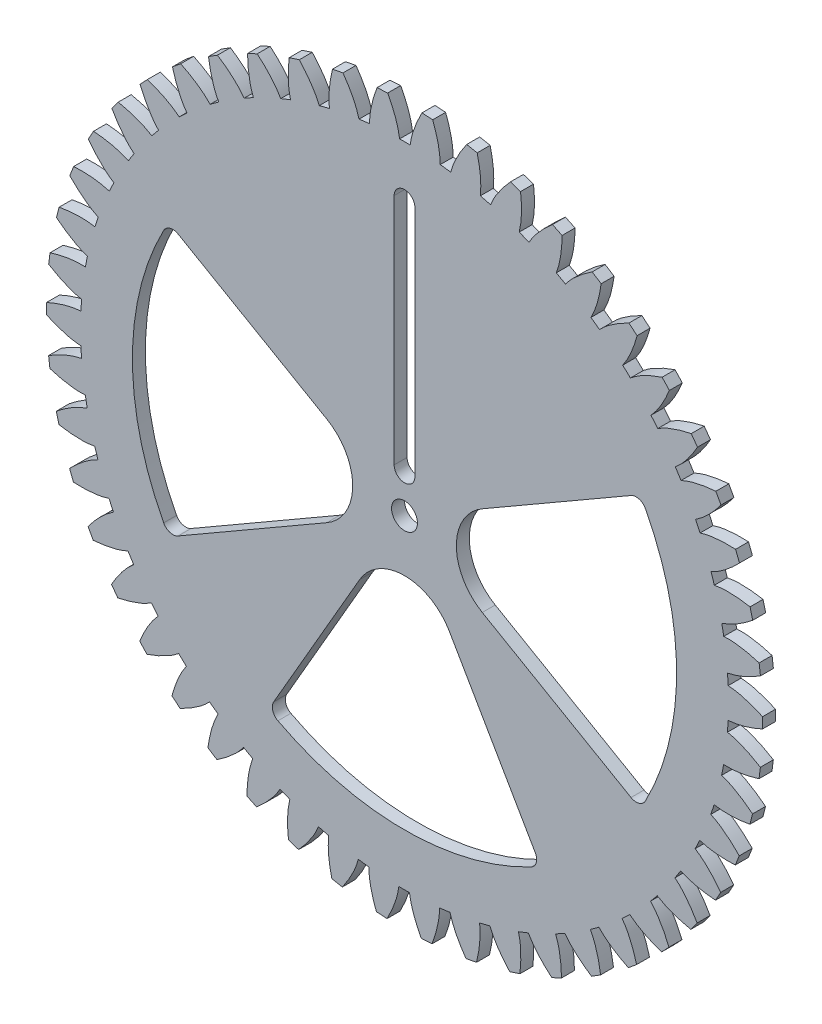
from build123d import *

# Parameters (mm, degrees)
SPIRALSKETCH_R      = 6.35
BOSS_EXTRUDE1_DEPTH = 6.35
CUT_EXTRUDE1_DEPTH  = 6.35


with BuildPart() as part:
    # spiralSketch → Boss-Extrude1 (new body)
    with BuildSketch(Plane.XY):
        with BuildLine():
            Line((30.468459497, 172.815087406), (35.608653157, 171.829582085))
            add(Edge.make_bspline(
                [(37.148806911, 154.342245173), (37.831936538, 160.209299594), (36.978815149, 166.129159813), (35.608653157, 171.829582085)],
                knots=[0, 0, 0, 0, 1, 1, 1, 1], degree=3))
            ThreePointArc((37.148806911, 154.342245173), (39.66463326, 153.714928905), (42.169878451, 153.046606795))
            add(Edge.make_bspline(
                [(42.169878451, 153.046606795), (44.310689074, 158.5527263), (47.962178229, 163.294360615), (51.887680307, 167.633678274)],
                knots=[0, 0, 0, 0, 1, 1, 1, 1], degree=3))
            Line((51.887680307, 167.633678274), (56.863825436, 166.011706865))
            add(Edge.make_bspline(
                [(56.200090136, 148.469230377), (57.613169984, 154.204402477), (57.508730936, 160.184507291), (56.863825436, 166.011706865)],
                knots=[0, 0, 0, 0, 1, 1, 1, 1], degree=3))
            ThreePointArc((56.200090136, 148.469230377), (58.617454866, 147.531544034), (61.01918248, 146.554501362))
            add(Edge.make_bspline(
                [(61.01918248, 146.554501362), (63.833211933, 151.748888752), (68.050192367, 155.995480921), (72.488601402, 159.808585896)],
                knots=[0, 0, 0, 0, 1, 1, 1, 1], degree=3))
            Line((72.488601402, 159.808585896), (77.222221219, 157.575727856))
            add(Edge.make_bspline(
                [(74.365064367, 140.254767126), (76.485809323, 145.767609814), (77.131699681, 151.7136494), (77.222221219, 157.575727856)],
                knots=[0, 0, 0, 0, 1, 1, 1, 1], degree=3))
            ThreePointArc((74.365064367, 140.254767126), (76.645844193, 139.021498582), (78.90617755, 137.751143895))
            add(Edge.make_bspline(
                [(78.90617755, 137.751143895), (82.349046908, 142.551880579), (87.06501432, 146.236459307), (91.94633395, 149.463216654)],
                knots=[0, 0, 0, 0, 1, 1, 1, 1], degree=3))
            Line((91.94633395, 149.463216654), (96.362776443, 146.654685488))
            add(Edge.make_bspline(
                [(91.357257109, 129.828402414), (94.152221758, 135.031974868), (95.538255446, 140.850176629), (96.362776443, 146.654685488)],
                knots=[0, 0, 0, 0, 1, 1, 1, 1], degree=3))
            ThreePointArc((91.357257109, 129.828402414), (93.46548277, 128.31900105), (95.548775063, 126.775368601))
            add(Edge.make_bspline(
                [(95.548775063, 126.775368601), (99.566188221, 131.106744093), (104.706768987, 134.171201371), (109.954017886, 136.7607232)],
                knots=[0, 0, 0, 0, 1, 1, 1, 1], degree=3))
            Line((109.954017886, 136.7607232), (113.983633118, 133.420811122))
            add(Edge.make_bspline(
                [(106.908691333, 117.35456624), (110.333797412, 122.166805014), (112.438115851, 127.765412432), (113.983633118, 133.420811122)],
                knots=[0, 0, 0, 0, 1, 1, 1, 1], degree=3))
            ThreePointArc((106.908691333, 117.35456624), (108.811114851, 115.592836218), (110.684511316, 113.800270012))
            add(Edge.make_bspline(
                [(110.684511316, 113.800270012), (115.213111267, 117.593975932), (120.697235358, 119.98998344), (126.227661276, 121.901431444)],
                knots=[0, 0, 0, 0, 1, 1, 1, 1], degree=3))
            Line((126.227661276, 121.901431444), (129.806899808, 118.082810864))
            add(Edge.make_bspline(
                [(120.77411163, 103.029978452), (124.775343171, 107.374991666), (127.564760002, 112.665711358), (129.806899808, 118.082810864)],
                knots=[0, 0, 0, 0, 1, 1, 1, 1], degree=3))
            ThreePointArc((120.77411163, 103.029978452), (122.44073065, 101.043703306), (124.074686705, 99.030473184))
            add(Edge.make_bspline(
                [(124.074686705, 99.030473184), (129.043054723, 102.226680524), (134.784234227, 103.916451792), (140.510619044, 105.119681294)],
                knots=[0, 0, 0, 0, 1, 1, 1, 1], degree=3))
            Line((140.510619044, 105.119681294), (143.583034146, 100.882574138))
            add(Edge.make_bspline(
                [(132.73485204, 87.080546357), (137.249107231, 90.889810556), (140.679631683, 95.789204712), (143.583034146, 100.882574138)],
                knots=[0, 0, 0, 0, 1, 1, 1, 1], degree=3))
            ThreePointArc((132.73485204, 87.080546357), (134.139382985, 84.901050833), (135.508130167, 82.698906635))
            add(Edge.make_bspline(
                [(135.508130167, 82.698906635), (140.83791212, 85.247209297), (146.745605205, 86.204095622), (152.577640412, 86.680130974)],
                knots=[0, 0, 0, 0, 1, 1, 1, 1], degree=3))
            Line((152.577640412, 86.680130974), (155.094778262, 82.091358955))
            add(Edge.make_bspline(
                [(142.602284541, 69.757802027), (147.558370882, 72.97124284), (151.575901536, 77.402045087), (155.094778262, 82.091358955)],
                knots=[0, 0, 0, 0, 1, 1, 1, 1], degree=3))
            ThreePointArc((142.602284541, 69.757802027), (143.722577118, 67.419458071), (144.804529467, 65.063128928))
            add(Edge.make_bspline(
                [(144.804529467, 65.063128928), (150.41167151, 66.923338655), (156.392710328, 67.132249368), (162.238421245, 66.873583209)],
                knots=[0, 0, 0, 0, 1, 1, 1, 1], degree=3))
            Line((162.238421245, 66.873583209), (164.160585077, 62.005514001))
            add(Edge.make_bspline(
                [(150.220793829, 51.334935487), (155.540550876, 53.901875032), (160.081728874, 57.794208973), (164.160585077, 62.005514001)],
                knots=[0, 0, 0, 0, 1, 1, 1, 1], degree=3))
            ThreePointArc((150.220793829, 51.334935487), (151.039180355, 48.87462018), (151.817274835, 46.40126681))
            add(Edge.make_bspline(
                [(151.817274835, 46.40126681), (157.613348989, 47.544046985), (163.573408985, 47.001687439), (169.340605259, 46.012399088)],
                knots=[0, 0, 0, 0, 1, 1, 1, 1], degree=3))
            Line((169.340605259, 46.012399088), (170.6374814, 40.941805052))
            add(Edge.make_bspline(
                [(155.47023146, 32.102486348), (161.069763468, 33.982442456), (166.062971719, 37.274923658), (170.6374814, 40.941805052)],
                knots=[0, 0, 0, 0, 1, 1, 1, 1], degree=3))
            ThreePointArc((155.47023146, 32.102486348), (155.973805491, 29.559000333), (156.435771088, 27.007628995))
            add(Edge.make_bspline(
                [(156.435771088, 27.007628995), (162.329369801, 27.414957292), (168.174457268, 26.129880822), (173.772186769, 24.425571947)],
                knots=[0, 0, 0, 0, 1, 1, 1, 1], degree=3))
            Line((173.772186769, 24.425571947), (174.423322707, 19.232419379))
            add(Edge.make_bspline(
                [(158.267810668, 12.363761823), (164.058809671, 13.527086463), (169.4253023, 16.167790531), (174.423322707, 19.232419379)],
                knots=[0, 0, 0, 0, 1, 1, 1, 1], degree=3))
            ThreePointArc((158.267810668, 12.363761823), (158.44863054, 9.777217393), (158.587181781, 7.188064738))
            add(Edge.make_bspline(
                [(158.587181781, 7.188064738), (164.48535948, 6.853517346), (170.123293897, 4.845990375), (175.463277087, 2.453538945)],
                knots=[0, 0, 0, 0, 1, 1, 1, 1], degree=3))
            Line((175.463277087, 2.453538945), (175.45840402, -2.780273036))
            add(Edge.make_bspline(
                [(158.569411957, -7.569946612), (164.460550442, -7.141599765), (170.115694653, -5.194318311), (175.45840402, -2.780273036)],
                knots=[0, 0, 0, 0, 1, 1, 1, 1], degree=3))
            ThreePointArc((158.569411957, -7.569946612), (158.424626033, -10.158758106), (158.237577882, -12.744859593))
            add(Edge.make_bspline(
                [(158.237577882, -12.744859593), (164.047316782, -13.816006663), (169.389184555, -16.514324235), (174.387206708, -19.557187831)],
                knots=[0, 0, 0, 0, 1, 1, 1, 1], degree=3))
            Line((174.387206708, -19.557187831), (173.726401487, -24.749118884))
            add(Edge.make_bspline(
                [(156.370278894, -27.384272467), (162.268650088, -27.697658698), (168.12326088, -26.474509651), (173.726401487, -24.749118884)],
                knots=[0, 0, 0, 0, 1, 1, 1, 1], degree=3))
            ThreePointArc((156.370278894, -27.384272467), (155.902170535, -29.934523921), (155.392472853, -32.476789876))
            add(Edge.make_bspline(
                [(155.392472853, -32.476789876), (161.0221499, -34.267643994), (165.983706584, -37.614198087), (170.560945906, -41.259486073)],
                knots=[0, 0, 0, 0, 1, 1, 1, 1], degree=3))
            Line((170.560945906, -41.259486073), (169.254629824, -46.327656344))
            add(Edge.make_bspline(
                [(151.705093123, -46.766731986), (157.517676188, -47.816909008), (163.47942285, -47.337182158), (169.254629824, -46.327656344)],
                knots=[0, 0, 0, 0, 1, 1, 1, 1], degree=3))
            ThreePointArc((151.705093123, -46.766731986), (150.921044677, -49.238204412), (150.0967357, -51.696541782))
            add(Edge.make_bspline(
                [(150.0967357, -51.696541782), (155.457567525, -54.178860108), (159.960566406, -58.120873566), (164.044837099, -62.311097571)],
                knots=[0, 0, 0, 0, 1, 1, 1, 1], degree=3))
            Line((164.044837099, -62.311097571), (162.113611541, -67.175578988))
            add(Edge.make_bspline(
                [(144.647427408, -65.411652205), (150.282554438, -67.182058099), (156.257416664, -67.453319025), (162.113611541, -67.175578988)],
                knots=[0, 0, 0, 0, 1, 1, 1, 1], degree=3))
            ThreePointArc((144.647427408, -65.411652205), (143.559803788, -67.765369005), (142.433883362, -70.101008342))
            add(Edge.make_bspline(
                [(142.433883362, -70.101008342), (147.441326444, -73.235643234), (151.414752541, -77.710948148), (154.941643215, -82.380025839)],
                knots=[0, 0, 0, 0, 1, 1, 1, 1], degree=3))
            Line((154.941643215, -82.380025839), (152.415964762, -86.964102622))
            add(Edge.make_bspline(
                [(135.308585355, -83.024991594), (140.67738703, -85.487706), (146.571137674, -86.505676756), (152.415964762, -86.964102622)],
                knots=[0, 0, 0, 0, 1, 1, 1, 1], degree=3))
            ThreePointArc((135.308585355, -83.024991594), (133.934539034, -85.223833249), (132.524763597, -87.399940124))
            add(Edge.make_bspline(
                [(132.524763597, -87.399940124), (137.099847567, -91.137456517), (140.481037577, -96.075474656), (143.39492706, -101.149771887)],
                knots=[0, 0, 0, 0, 1, 1, 1, 1], degree=3))
            Line((143.39492706, -101.149771887), (140.31462717, -105.381150409))
            add(Edge.make_bspline(
                [(123.835846082, -99.328977268), (128.853653192, -102.445161711), (134.573344285, -104.193788289), (140.31462717, -105.381150409)],
                knots=[0, 0, 0, 0, 1, 1, 1, 1], degree=3))
            ThreePointArc((123.835846082, -99.328977268), (122.197046592, -101.338266732), (120.525649144, -103.32052264))
            add(Edge.make_bspline(
                [(120.525649144, -103.32052264), (124.596222196, -107.601977667), (127.331852731, -112.924833536), (129.586787245, -118.324325609)],
                knots=[0, 0, 0, 0, 1, 1, 1, 1], degree=3))
            Line((129.586787245, -118.324325609), (126.000444087, -122.136274501))
            add(Edge.make_bspline(
                [(110.41014154, -114.066485635), (114.99782027, -117.786996023), (120.453248867, -120.238701538), (126.000444087, -122.136274501)],
                knots=[0, 0, 0, 0, 1, 1, 1, 1], degree=3))
            ThreePointArc((110.41014154, -114.066485635), (108.532433728, -115.854535212), (106.625773205, -117.611678793))
            add(Edge.make_bspline(
                [(106.625773205, -117.611678793), (110.12763997, -122.369551352), (112.174568503, -127.993300333), (113.734986384, -133.632834032)],
                knots=[0, 0, 0, 0, 1, 1, 1, 1], degree=3))
            Line((113.734986384, -133.632834032), (109.699158732, -136.965236585))
            add(Edge.make_bspline(
                [(95.24320311, -127.005097383), (99.328403025, -131.271259045), (104.433533758, -134.387378636), (109.699158732, -136.965236585)],
                knots=[0, 0, 0, 0, 1, 1, 1, 1], degree=3))
            ThreePointArc((95.24320311, -127.005097383), (93.15619955, -128.543708463), (91.044345128, -130.048028514))
            add(Edge.make_bspline(
                [(91.044345128, -130.048028514), (93.922279074, -135.207284112), (95.24822432, -141.043236325), (96.089516846, -146.833872835)],
                knots=[0, 0, 0, 0, 1, 1, 1, 1], degree=3))
            Line((96.089516846, -146.833872835), (91.667852113, -149.634175068))
            add(Edge.make_bspline(
                [(78.574222471, -137.940762877), (82.092517529, -142.685295895), (86.766839437, -146.416686495), (91.667852113, -149.634175068)],
                knots=[0, 0, 0, 0, 1, 1, 1, 1], degree=3))
            ThreePointArc((78.574222471, -137.940762877), (76.310836456, -139.205670644), (74.02709334, -140.433443138))
            add(Edge.make_bspline(
                [(74.02709334, -140.433443138), (76.235707731, -145.912717232), (76.819758741, -151.868836224), (76.928658226, -157.719253748)],
                knots=[0, 0, 0, 0, 1, 1, 1, 1], degree=3))
            Line((76.928658226, -157.719253748), (72.190888706, -159.943293223))
            add(Edge.make_bspline(
                [(60.666079407, -146.701020138), (63.561983992, -151.849100392), (67.731780226, -156.136915742), (72.190888706, -159.943293223)],
                knots=[0, 0, 0, 0, 1, 1, 1, 1], degree=3))
            ThreePointArc((60.666079407, -146.701020138), (58.262005885, -147.672276241), (55.84239007, -148.604138473))
            add(Edge.make_bspline(
                [(55.84239007, -148.604138473), (57.346853736, -154.317019638), (57.179799677, -160.299373854), (56.55458871, -166.117307813)],
                knots=[0, 0, 0, 0, 1, 1, 1, 1], degree=3))
            Line((56.55458871, -166.117307813), (51.57543186, -167.730010099))
            add(Edge.make_bspline(
                [(41.801196029, -153.147714676), (44.029039997, -158.618153866), (47.62855038, -163.394772556), (51.57543186, -167.730010099)],
                knots=[0, 0, 0, 0, 1, 1, 1, 1], degree=3))
            ThreePointArc((41.801196029, -153.147714676), (39.294348678, -153.810001827), (36.777018949, -154.431257773))
            add(Edge.make_bspline(
                [(36.777018949, -154.431257773), (37.553605601, -160.287650459), (36.638081014, -166.2018946), (35.288619547, -171.8955927)],
                knots=[0, 0, 0, 0, 1, 1, 1, 1], degree=3))
            Line((35.288619547, -171.8955927), (30.146599644, -172.871524518))
            add(Edge.make_bspline(
                [(22.27708282, -157.179178268), (23.80173174, -162.885704299), (26.774189842, -168.0757962), (30.146599644, -172.871524518)],
                knots=[0, 0, 0, 0, 1, 1, 1, 1], degree=3))
            ThreePointArc((22.27708282, -157.179178268), (19.706996118, -157.522051802), (17.131652269, -157.822903884))
            add(Edge.make_bspline(
                [(17.131652269, -157.822903884), (17.168114671, -163.730449282), (15.518557928, -169.483312184), (13.466127773, -174.962981405)],
                knots=[0, 0, 0, 0, 1, 1, 1, 1], degree=3))
            Line((13.466127773, -174.962981405), (8.242337542, -175.286751727))
            add(Edge.make_bspline(
                [(2.401646707, -158.731832325), (3.199055955, -164.584449872), (5.497584337, -170.106164134), (8.242337542, -175.286751727)],
                knots=[0, 0, 0, 0, 1, 1, 1, 1], degree=3))
            ThreePointArc((2.401646707, -158.731832325), (-0.191147542, -158.749884922), (-2.7838908, -158.725588523))
            add(Edge.make_bspline(
                [(-2.7838908, -158.725588523), (-3.488127682, -164.591121111), (-5.845702088, -170.091876691), (-8.56873288, -175.271099375)],
                knots=[0, 0, 0, 0, 1, 1, 1, 1], degree=3))
            Line((-8.56873288, -175.271099375), (-13.791911146, -174.937602151))
            add(Edge.make_bspline(
                [(-17.51166481, -157.781190563), (-17.454070854, -163.687600353), (-15.865721358, -169.453856244), (-13.791911146, -174.937602151)],
                knots=[0, 0, 0, 0, 1, 1, 1, 1], degree=3))
            ThreePointArc((-17.51166481, -157.781190563), (-20.086276692, -157.474137523), (-22.655530249, -157.125075813))
            add(Edge.make_bspline(
                [(-22.655530249, -157.125075813), (-24.089360178, -162.856092639), (-27.11777189, -168.017990694), (-30.468459497, -172.815087406)],
                knots=[0, 0, 0, 0, 1, 1, 1, 1], degree=3))
            Line((-30.468459497, -172.815087406), (-35.608653157, -171.829582085))
            add(Edge.make_bspline(
                [(-37.148806911, -154.342245173), (-37.831936538, -160.209299595), (-36.978815149, -166.129159813), (-35.608653157, -171.829582085)],
                knots=[0, 0, 0, 0, 1, 1, 1, 1], degree=3))
            ThreePointArc((-37.148806911, -154.342245173), (-39.664633259, -153.714928905), (-42.169878451, -153.046606795))
            add(Edge.make_bspline(
                [(-42.169878451, -153.046606795), (-44.310689074, -158.5527263), (-47.962178229, -163.294360615), (-51.887680306, -167.633678274)],
                knots=[0, 0, 0, 0, 1, 1, 1, 1], degree=3))
            Line((-51.887680306, -167.633678274), (-56.863825436, -166.011706865))
            add(Edge.make_bspline(
                [(-56.200090136, -148.469230377), (-57.613169984, -154.204402477), (-57.508730936, -160.184507291), (-56.863825436, -166.011706865)],
                knots=[0, 0, 0, 0, 1, 1, 1, 1], degree=3))
            ThreePointArc((-56.200090136, -148.469230377), (-58.617454866, -147.531544034), (-61.01918248, -146.554501362))
            add(Edge.make_bspline(
                [(-61.01918248, -146.554501362), (-63.833211933, -151.748888752), (-68.050192367, -155.995480921), (-72.488601402, -159.808585896)],
                knots=[0, 0, 0, 0, 1, 1, 1, 1], degree=3))
            Line((-72.488601402, -159.808585896), (-77.222221219, -157.575727856))
            add(Edge.make_bspline(
                [(-74.365064367, -140.254767126), (-76.485809323, -145.767609815), (-77.131699681, -151.7136494), (-77.222221219, -157.575727856)],
                knots=[0, 0, 0, 0, 1, 1, 1, 1], degree=3))
            ThreePointArc((-74.365064367, -140.254767126), (-76.645844193, -139.021498582), (-78.90617755, -137.751143896))
            add(Edge.make_bspline(
                [(-78.90617755, -137.751143896), (-82.349046908, -142.551880579), (-87.06501432, -146.236459307), (-91.94633395, -149.463216654)],
                knots=[0, 0, 0, 0, 1, 1, 1, 1], degree=3))
            Line((-91.94633395, -149.463216654), (-96.362776443, -146.654685488))
            add(Edge.make_bspline(
                [(-91.357257109, -129.828402414), (-94.152221758, -135.031974868), (-95.538255446, -140.850176629), (-96.362776443, -146.654685488)],
                knots=[0, 0, 0, 0, 1, 1, 1, 1], degree=3))
            ThreePointArc((-91.357257109, -129.828402414), (-93.46548277, -128.31900105), (-95.548775063, -126.775368601))
            add(Edge.make_bspline(
                [(-95.548775063, -126.775368601), (-99.566188221, -131.106744093), (-104.706768987, -134.171201371), (-109.954017886, -136.7607232)],
                knots=[0, 0, 0, 0, 1, 1, 1, 1], degree=3))
            Line((-109.954017886, -136.7607232), (-113.983633118, -133.420811122))
            add(Edge.make_bspline(
                [(-106.908691333, -117.35456624), (-110.333797412, -122.166805014), (-112.438115851, -127.765412432), (-113.983633118, -133.420811122)],
                knots=[0, 0, 0, 0, 1, 1, 1, 1], degree=3))
            ThreePointArc((-106.908691333, -117.35456624), (-108.811114851, -115.592836218), (-110.684511316, -113.800270012))
            add(Edge.make_bspline(
                [(-110.684511316, -113.800270012), (-115.213111267, -117.593975932), (-120.697235358, -119.98998344), (-126.227661276, -121.901431444)],
                knots=[0, 0, 0, 0, 1, 1, 1, 1], degree=3))
            Line((-126.227661276, -121.901431444), (-129.806899808, -118.082810864))
            add(Edge.make_bspline(
                [(-120.77411163, -103.029978452), (-124.775343171, -107.374991666), (-127.564760002, -112.665711358), (-129.806899808, -118.082810864)],
                knots=[0, 0, 0, 0, 1, 1, 1, 1], degree=3))
            ThreePointArc((-120.77411163, -103.029978452), (-122.44073065, -101.043703306), (-124.074686705, -99.030473184))
            add(Edge.make_bspline(
                [(-124.074686705, -99.030473184), (-129.043054723, -102.226680524), (-134.784234227, -103.916451792), (-140.510619044, -105.119681294)],
                knots=[0, 0, 0, 0, 1, 1, 1, 1], degree=3))
            Line((-140.510619044, -105.119681294), (-143.583034146, -100.882574138))
            add(Edge.make_bspline(
                [(-132.73485204, -87.080546357), (-137.249107231, -90.889810557), (-140.679631683, -95.789204712), (-143.583034146, -100.882574138)],
                knots=[0, 0, 0, 0, 1, 1, 1, 1], degree=3))
            ThreePointArc((-132.73485204, -87.080546357), (-134.139382985, -84.901050833), (-135.508130167, -82.698906636))
            add(Edge.make_bspline(
                [(-135.508130167, -82.698906636), (-140.83791212, -85.247209297), (-146.745605205, -86.204095622), (-152.577640412, -86.680130974)],
                knots=[0, 0, 0, 0, 1, 1, 1, 1], degree=3))
            Line((-152.577640412, -86.680130974), (-155.094778262, -82.091358955))
            add(Edge.make_bspline(
                [(-142.602284541, -69.757802027), (-147.558370882, -72.97124284), (-151.575901536, -77.402045087), (-155.094778262, -82.091358955)],
                knots=[0, 0, 0, 0, 1, 1, 1, 1], degree=3))
            ThreePointArc((-142.602284541, -69.757802027), (-143.722577118, -67.419458071), (-144.804529467, -65.063128928))
            add(Edge.make_bspline(
                [(-144.804529467, -65.063128928), (-150.41167151, -66.923338655), (-156.392710328, -67.132249368), (-162.238421245, -66.873583209)],
                knots=[0, 0, 0, 0, 1, 1, 1, 1], degree=3))
            Line((-162.238421245, -66.873583209), (-164.160585077, -62.005514001))
            add(Edge.make_bspline(
                [(-150.220793829, -51.334935487), (-155.540550876, -53.901875032), (-160.081728874, -57.794208973), (-164.160585077, -62.005514001)],
                knots=[0, 0, 0, 0, 1, 1, 1, 1], degree=3))
            ThreePointArc((-150.220793829, -51.334935487), (-151.039180355, -48.87462018), (-151.817274835, -46.40126681))
            add(Edge.make_bspline(
                [(-151.817274835, -46.40126681), (-157.613348989, -47.544046985), (-163.573408985, -47.001687439), (-169.340605259, -46.012399088)],
                knots=[0, 0, 0, 0, 1, 1, 1, 1], degree=3))
            Line((-169.340605259, -46.012399088), (-170.6374814, -40.941805052))
            add(Edge.make_bspline(
                [(-155.47023146, -32.102486348), (-161.069763468, -33.982442456), (-166.062971719, -37.274923658), (-170.6374814, -40.941805052)],
                knots=[0, 0, 0, 0, 1, 1, 1, 1], degree=3))
            ThreePointArc((-155.47023146, -32.102486348), (-155.973805491, -29.559000333), (-156.435771088, -27.007628996))
            add(Edge.make_bspline(
                [(-156.435771088, -27.007628996), (-162.329369801, -27.414957292), (-168.174457268, -26.129880822), (-173.772186769, -24.425571947)],
                knots=[0, 0, 0, 0, 1, 1, 1, 1], degree=3))
            Line((-173.772186769, -24.425571947), (-174.423322707, -19.232419379))
            add(Edge.make_bspline(
                [(-158.267810668, -12.363761823), (-164.058809671, -13.527086463), (-169.4253023, -16.167790531), (-174.423322707, -19.232419379)],
                knots=[0, 0, 0, 0, 1, 1, 1, 1], degree=3))
            ThreePointArc((-158.267810668, -12.363761823), (-158.44863054, -9.777217393), (-158.587181781, -7.188064739))
            add(Edge.make_bspline(
                [(-158.587181781, -7.188064739), (-164.48535948, -6.853517346), (-170.123293897, -4.845990375), (-175.463277087, -2.453538945)],
                knots=[0, 0, 0, 0, 1, 1, 1, 1], degree=3))
            Line((-175.463277087, -2.453538945), (-175.45840402, 2.780273036))
            add(Edge.make_bspline(
                [(-158.569411957, 7.569946612), (-164.460550442, 7.141599765), (-170.115694653, 5.194318312), (-175.45840402, 2.780273036)],
                knots=[0, 0, 0, 0, 1, 1, 1, 1], degree=3))
            ThreePointArc((-158.569411957, 7.569946612), (-158.424626033, 10.158758106), (-158.237577882, 12.744859593))
            add(Edge.make_bspline(
                [(-158.237577882, 12.744859593), (-164.047316782, 13.816006663), (-169.389184555, 16.514324235), (-174.387206708, 19.557187831)],
                knots=[0, 0, 0, 0, 1, 1, 1, 1], degree=3))
            Line((-174.387206708, 19.557187831), (-173.726401487, 24.749118884))
            add(Edge.make_bspline(
                [(-156.370278894, 27.384272467), (-162.268650088, 27.697658699), (-168.123260879, 26.474509651), (-173.726401487, 24.749118884)],
                knots=[0, 0, 0, 0, 1, 1, 1, 1], degree=3))
            ThreePointArc((-156.370278894, 27.384272467), (-155.902170535, 29.934523921), (-155.392472853, 32.476789876))
            add(Edge.make_bspline(
                [(-155.392472853, 32.476789876), (-161.0221499, 34.267643994), (-165.983706584, 37.614198087), (-170.560945906, 41.259486073)],
                knots=[0, 0, 0, 0, 1, 1, 1, 1], degree=3))
            Line((-170.560945906, 41.259486073), (-169.254629824, 46.327656344))
            add(Edge.make_bspline(
                [(-151.705093123, 46.766731986), (-157.517676188, 47.816909008), (-163.47942285, 47.337182158), (-169.254629824, 46.327656344)],
                knots=[0, 0, 0, 0, 1, 1, 1, 1], degree=3))
            ThreePointArc((-151.705093123, 46.766731986), (-150.921044677, 49.238204412), (-150.0967357, 51.696541782))
            add(Edge.make_bspline(
                [(-150.0967357, 51.696541782), (-155.457567525, 54.178860108), (-159.960566406, 58.120873566), (-164.044837099, 62.311097571)],
                knots=[0, 0, 0, 0, 1, 1, 1, 1], degree=3))
            Line((-164.044837099, 62.311097571), (-162.113611541, 67.175578988))
            add(Edge.make_bspline(
                [(-144.647427408, 65.411652205), (-150.282554438, 67.182058099), (-156.257416664, 67.453319025), (-162.113611541, 67.175578988)],
                knots=[0, 0, 0, 0, 1, 1, 1, 1], degree=3))
            ThreePointArc((-144.647427408, 65.411652205), (-143.559803788, 67.765369005), (-142.433883362, 70.101008342))
            add(Edge.make_bspline(
                [(-142.433883362, 70.101008342), (-147.441326444, 73.235643234), (-151.414752541, 77.710948148), (-154.941643215, 82.380025839)],
                knots=[0, 0, 0, 0, 1, 1, 1, 1], degree=3))
            Line((-154.941643215, 82.380025839), (-152.415964762, 86.964102622))
            add(Edge.make_bspline(
                [(-135.308585355, 83.024991594), (-140.67738703, 85.487706), (-146.571137674, 86.505676756), (-152.415964762, 86.964102622)],
                knots=[0, 0, 0, 0, 1, 1, 1, 1], degree=3))
            ThreePointArc((-135.308585355, 83.024991594), (-133.934539034, 85.223833249), (-132.524763597, 87.399940124))
            add(Edge.make_bspline(
                [(-132.524763597, 87.399940124), (-137.099847567, 91.137456517), (-140.481037577, 96.075474656), (-143.39492706, 101.149771887)],
                knots=[0, 0, 0, 0, 1, 1, 1, 1], degree=3))
            Line((-143.39492706, 101.149771887), (-140.31462717, 105.381150409))
            add(Edge.make_bspline(
                [(-123.835846082, 99.328977268), (-128.853653192, 102.445161711), (-134.573344285, 104.193788289), (-140.31462717, 105.381150409)],
                knots=[0, 0, 0, 0, 1, 1, 1, 1], degree=3))
            ThreePointArc((-123.835846082, 99.328977268), (-122.197046592, 101.338266732), (-120.525649144, 103.320522639))
            add(Edge.make_bspline(
                [(-120.525649144, 103.320522639), (-124.596222196, 107.601977667), (-127.331852731, 112.924833536), (-129.586787245, 118.324325609)],
                knots=[0, 0, 0, 0, 1, 1, 1, 1], degree=3))
            Line((-129.586787245, 118.324325609), (-126.000444087, 122.136274501))
            add(Edge.make_bspline(
                [(-110.41014154, 114.066485635), (-114.99782027, 117.786996023), (-120.453248867, 120.238701538), (-126.000444087, 122.136274501)],
                knots=[0, 0, 0, 0, 1, 1, 1, 1], degree=3))
            ThreePointArc((-110.41014154, 114.066485635), (-108.532433728, 115.854535212), (-106.625773205, 117.611678793))
            add(Edge.make_bspline(
                [(-106.625773205, 117.611678793), (-110.12763997, 122.369551352), (-112.174568503, 127.993300333), (-113.734986384, 133.632834032)],
                knots=[0, 0, 0, 0, 1, 1, 1, 1], degree=3))
            Line((-113.734986384, 133.632834032), (-109.699158732, 136.965236585))
            add(Edge.make_bspline(
                [(-95.24320311, 127.005097383), (-99.328403025, 131.271259045), (-104.433533758, 134.387378636), (-109.699158732, 136.965236585)],
                knots=[0, 0, 0, 0, 1, 1, 1, 1], degree=3))
            ThreePointArc((-95.24320311, 127.005097383), (-93.15619955, 128.543708463), (-91.044345128, 130.048028514))
            add(Edge.make_bspline(
                [(-91.044345128, 130.048028514), (-93.922279074, 135.207284112), (-95.24822432, 141.043236325), (-96.089516846, 146.833872835)],
                knots=[0, 0, 0, 0, 1, 1, 1, 1], degree=3))
            Line((-96.089516846, 146.833872835), (-91.667852113, 149.634175068))
            add(Edge.make_bspline(
                [(-78.574222471, 137.940762877), (-82.092517529, 142.685295895), (-86.766839437, 146.416686495), (-91.667852113, 149.634175068)],
                knots=[0, 0, 0, 0, 1, 1, 1, 1], degree=3))
            ThreePointArc((-78.574222471, 137.940762877), (-76.310836456, 139.205670644), (-74.02709334, 140.433443138))
            add(Edge.make_bspline(
                [(-74.02709334, 140.433443138), (-76.235707731, 145.912717232), (-76.819758741, 151.868836224), (-76.928658226, 157.719253748)],
                knots=[0, 0, 0, 0, 1, 1, 1, 1], degree=3))
            Line((-76.928658226, 157.719253748), (-72.190888706, 159.943293223))
            add(Edge.make_bspline(
                [(-60.666079407, 146.701020138), (-63.561983992, 151.849100392), (-67.731780226, 156.136915742), (-72.190888706, 159.943293223)],
                knots=[0, 0, 0, 0, 1, 1, 1, 1], degree=3))
            ThreePointArc((-60.666079407, 146.701020138), (-58.262005885, 147.672276241), (-55.84239007, 148.604138473))
            add(Edge.make_bspline(
                [(-55.84239007, 148.604138473), (-57.346853736, 154.317019638), (-57.179799677, 160.299373854), (-56.55458871, 166.117307813)],
                knots=[0, 0, 0, 0, 1, 1, 1, 1], degree=3))
            Line((-56.55458871, 166.117307813), (-51.57543186, 167.730010099))
            add(Edge.make_bspline(
                [(-41.801196029, 153.147714676), (-44.029039997, 158.618153866), (-47.62855038, 163.394772556), (-51.57543186, 167.730010099)],
                knots=[0, 0, 0, 0, 1, 1, 1, 1], degree=3))
            ThreePointArc((-41.801196029, 153.147714676), (-39.294348678, 153.810001827), (-36.777018949, 154.431257773))
            add(Edge.make_bspline(
                [(-36.777018949, 154.431257773), (-37.553605601, 160.287650459), (-36.638081014, 166.2018946), (-35.288619547, 171.8955927)],
                knots=[0, 0, 0, 0, 1, 1, 1, 1], degree=3))
            Line((-35.288619547, 171.8955927), (-30.146599644, 172.871524518))
            add(Edge.make_bspline(
                [(-22.27708282, 157.179178268), (-23.80173174, 162.885704299), (-26.774189842, 168.0757962), (-30.146599644, 172.871524518)],
                knots=[0, 0, 0, 0, 1, 1, 1, 1], degree=3))
            ThreePointArc((-22.27708282, 157.179178268), (-19.706996118, 157.522051802), (-17.131652269, 157.822903884))
            add(Edge.make_bspline(
                [(-17.131652269, 157.822903884), (-17.168114671, 163.730449282), (-15.518557928, 169.483312184), (-13.466127773, 174.962981405)],
                knots=[0, 0, 0, 0, 1, 1, 1, 1], degree=3))
            Line((-13.466127773, 174.962981405), (-8.242337542, 175.286751727))
            add(Edge.make_bspline(
                [(-2.401646707, 158.731832325), (-3.199055955, 164.584449872), (-5.497584336, 170.106164134), (-8.242337542, 175.286751727)],
                knots=[0, 0, 0, 0, 1, 1, 1, 1], degree=3))
            ThreePointArc((-2.401646707, 158.731832325), (0.191147542, 158.749884922), (2.7838908, 158.725588523))
            add(Edge.make_bspline(
                [(2.7838908, 158.725588523), (3.488127682, 164.591121111), (5.845702088, 170.091876691), (8.56873288, 175.271099375)],
                knots=[0, 0, 0, 0, 1, 1, 1, 1], degree=3))
            Line((8.56873288, 175.271099375), (13.791911146, 174.937602151))
            add(Edge.make_bspline(
                [(17.51166481, 157.781190563), (17.454070854, 163.687600353), (15.865721358, 169.453856244), (13.791911146, 174.937602151)],
                knots=[0, 0, 0, 0, 1, 1, 1, 1], degree=3))
            ThreePointArc((17.51166481, 157.781190563), (20.086276692, 157.474137523), (22.655530249, 157.125075813))
            add(Edge.make_bspline(
                [(22.655530249, 157.125075813), (24.089360178, 162.856092639), (27.11777189, 168.017990694), (30.468459497, 172.815087406)],
                knots=[0, 0, 0, 0, 1, 1, 1, 1], degree=3))
        make_face()
        Circle(SPIRALSKETCH_R, mode=Mode.SUBTRACT)
        with BuildLine():
            Line((-5.08, 19.05), (-5.08, 133.35))
            ThreePointArc((-5.08, 133.35), (0, 138.43), (5.08, 133.35))
            Line((5.08, 133.35), (5.08, 19.05))
            ThreePointArc((5.08, 19.05), (0, 13.97), (-5.08, 19.05))
        make_face(mode=Mode.SUBTRACT)
    extrude(amount=BOSS_EXTRUDE1_DEPTH)

    # Sketch1 → Cut-Extrude1 (cut)
    with BuildSketch(Plane.XY.offset(6.35)):
        with BuildLine():
            Line((38.1, 21.997045256), (110.997927346, 64.084683232))
            ThreePointArc((110.997927346, 64.084683232), (114.949655653, 64.565174097), (118.034478924, 62.049047416))
            ThreePointArc((118.034478924, 62.049047416), (133.35, 0), (118.034478924, -62.049047416))
            ThreePointArc((118.034478924, -62.049047416), (114.949655653, -64.565174097), (110.997927346, -64.084683232))
            Line((110.997927346, -64.084683232), (38.1, -21.997045256))
            ThreePointArc((38.1, -21.997045256), (25.4, 0), (38.1, 21.997045256))
        make_face()
        with BuildLine():
            Line((-64.084683232, -110.997927346), (-21.997045256, -38.1))
            ThreePointArc((-21.997045256, -38.1), (0, -25.4), (21.997045256, -38.1))
            Line((21.997045256, -38.1), (64.084683232, -110.997927346))
            ThreePointArc((64.084683232, -110.997927346), (64.565174097, -114.949655653), (62.049047416, -118.034478924))
            ThreePointArc((62.049047416, -118.034478924), (0, -133.35), (-62.049047416, -118.034478924))
            ThreePointArc((-62.049047416, -118.034478924), (-64.565174097, -114.949655653), (-64.084683232, -110.997927346))
        make_face()
        with BuildLine():
            Line((-110.997927346, 64.084683232), (-38.1, 21.997045256))
            ThreePointArc((-38.1, 21.997045256), (-25.4, 0), (-38.1, -21.997045256))
            Line((-38.1, -21.997045256), (-110.997927346, -64.084683232))
            ThreePointArc((-110.997927346, -64.084683232), (-114.949655653, -64.565174097), (-118.034478924, -62.049047416))
            ThreePointArc((-118.034478924, -62.049047416), (-133.35, 0), (-118.034478924, 62.049047416))
            ThreePointArc((-118.034478924, 62.049047416), (-114.949655653, 64.565174097), (-110.997927346, 64.084683232))
        make_face()
    extrude(amount=-CUT_EXTRUDE1_DEPTH, mode=Mode.SUBTRACT)


solid = part.part
